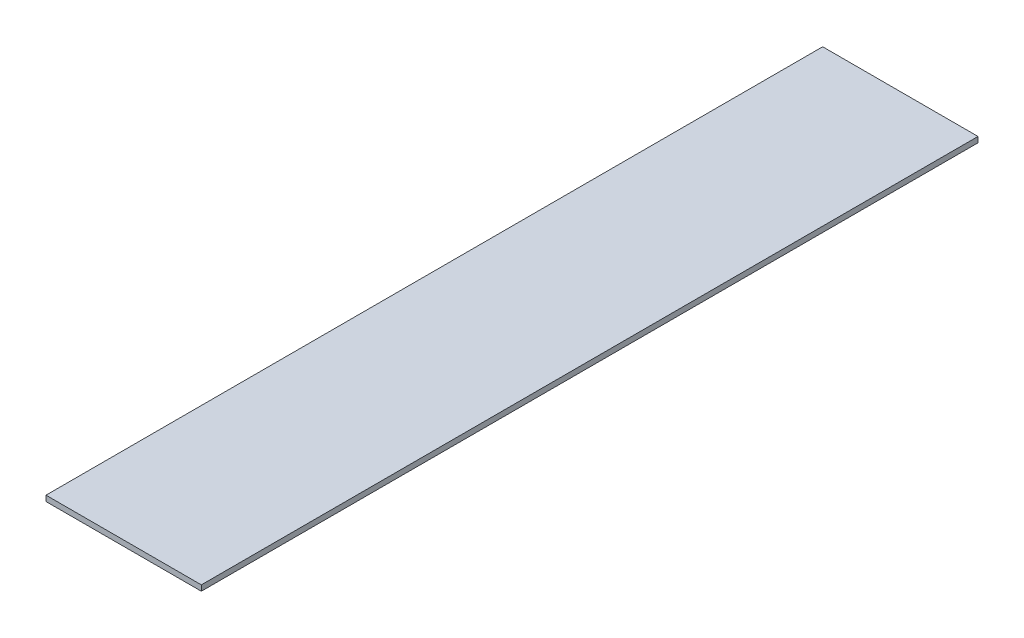
from build123d import *

# Parameters (mm, degrees)
SKETCH1_W           = 355.6
SKETCH1_H           = 1778
BOSS_EXTRUDE1_DEPTH = 12.7


with BuildPart() as part:
    # Sketch1 → Boss-Extrude1 (new body)
    with BuildSketch(Plane(origin=(0, 0, 0), x_dir=(1, 0, 0), z_dir=(0, 1, 0))):
        with Locations((177.8, 889)):
            Rectangle(SKETCH1_W, SKETCH1_H)
    extrude(amount=BOSS_EXTRUDE1_DEPTH)


solid = part.part
